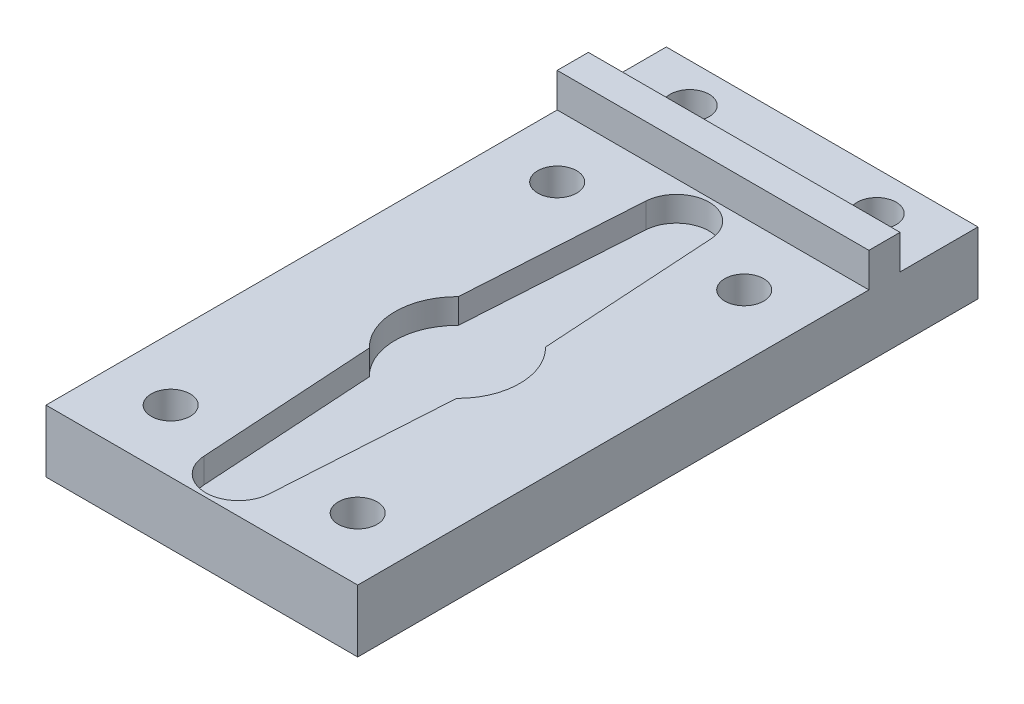
from build123d import *

# Parameters (mm, degrees)
SKETCH_1_W          = 20
SKETCH_1_H          = 32.8
EXTRUDE_1_DEPTH     = 4
CUT_EXTRUDE_1_DEPTH = 1.6
SKETCH_4_R          = 2
CUT_EXTRUDE_2_DEPTH = 1.5
SKETCH_4_3_R        = 1.25
CUT_EXTRUDE_3_DEPTH = 39.624344655
SKETCH_5_W          = 20
SKETCH_5_H          = 6.2
EXTRUDE_4_DEPTH     = 2
EXTRUDE_START       = 2
SKETCH_5_6_W        = 20
SKETCH_5_6_H        = 4
EXTRUDE_5_DEPTH     = 5
SKETCH_6_R          = 1.25
CUT_EXTRUDE_4_DEPTH = 39.913750783
SKETCH_6_3_R        = 2
CUT_EXTRUDE_5_DEPTH = 1.5


with BuildPart() as part:
    # 草图1 → 凸台-拉伸1 (new body)
    with BuildSketch(Plane(origin=(0, 0, 0), x_dir=(1, 0, 0), z_dir=(0, 1, 0))):
        with Locations((10, -16.4)):
            Rectangle(SKETCH_1_W, SKETCH_1_H)
    extrude(amount=EXTRUDE_1_DEPTH)

    # 草图3 → 切除-拉伸1 (cut)
    with BuildSketch(Plane(origin=(0, 4, 0), x_dir=(-1, 0, 0), z_dir=(0, 1, 0))):
        with BuildLine():
            Line((-12.8, 13.543428629), (-12.095952788, 2.219685343))
            ThreePointArc((-12.095952788, 2.219685343), (-10, 0.25), (-7.904047212, 2.219685343))
            Line((-7.904047212, 2.219685343), (-7.2, 13.543428629))
            ThreePointArc((-7.2, 13.543428629), (-6, 16.4), (-7.2, 19.256571371))
            Line((-7.2, 19.256571371), (-7.904047212, 30.580314657))
            ThreePointArc((-7.904047212, 30.580314657), (-10, 32.55), (-12.095952788, 30.580314657))
            Line((-12.095952788, 30.580314657), (-12.8, 19.256571371))
            ThreePointArc((-12.8, 19.256571371), (-14, 16.4), (-12.8, 13.543428629))
        make_face()
    extrude(amount=-CUT_EXTRUDE_1_DEPTH, mode=Mode.SUBTRACT)

    # 草图4 → 切除-拉伸2 (cut)
    with BuildSketch(Plane.XZ):
        with Locations(Location((4, 4, 0), (0, 0, 270))):
            Circle(SKETCH_4_R)
        with Locations(Location((4, 28.8, 0), (0, 0, 270))):
            Circle(SKETCH_4_R)
        with Locations(Location((16, 28.8, 0), (0, 0, 270))):
            Circle(SKETCH_4_R)
        with Locations(Location((16, 4, 0), (0, 0, 270))):
            Circle(SKETCH_4_R)
    extrude(amount=-CUT_EXTRUDE_2_DEPTH, mode=Mode.SUBTRACT)

    # 草图4<3> → 切除-拉伸3 (cut, through all)
    with BuildSketch(Plane.XZ):
        with Locations(Location((4, 4, 0), (0, 0, 270))):
            Circle(SKETCH_4_3_R)
        with Locations(Location((4, 28.8, 0), (0, 0, 270))):
            Circle(SKETCH_4_3_R)
        with Locations(Location((16, 4, 0), (0, 0, 270))):
            Circle(SKETCH_4_3_R)
        with Locations(Location((16, 28.8, 0), (0, 0, 270))):
            Circle(SKETCH_4_3_R)
    extrude(amount=-CUT_EXTRUDE_3_DEPTH, mode=Mode.SUBTRACT)

    # 草图5 → 凸台-拉伸4 (add)
    with BuildSketch(Plane(origin=(0, 0, 0), x_dir=(-1, 0, 0), z_dir=(0, 0, -1))):
        with Locations((-10, 3.1)):
            Rectangle(SKETCH_5_W, SKETCH_5_H)
    extrude(amount=EXTRUDE_4_DEPTH)

    # 草图5<6> → 凸台-拉伸5 (add)
    with BuildSketch(Plane(origin=(0, 0, 0), x_dir=(-1, 0, 0), z_dir=(0, 0, -1)).offset(EXTRUDE_START)):
        with Locations((-10, 2)):
            Rectangle(SKETCH_5_6_W, SKETCH_5_6_H)
    extrude(amount=EXTRUDE_5_DEPTH)

    # 草图6 → 切除-拉伸4 (cut, through all)
    with BuildSketch(Plane.XZ):
        with Locations(Location((4, -4.5, 0), (0, 0, 270))):
            Circle(SKETCH_6_R)
        with Locations(Location((16, -4.5, 0), (0, 0, 270))):
            Circle(SKETCH_6_R)
    extrude(amount=-CUT_EXTRUDE_4_DEPTH, mode=Mode.SUBTRACT)

    # 草图6<3> → 切除-拉伸5 (cut)
    with BuildSketch(Plane.XZ):
        with Locations(Location((4, -4.5, 0), (0, 0, 270))):
            Circle(SKETCH_6_3_R)
        with Locations(Location((16, -4.5, 0), (0, 0, 270))):
            Circle(SKETCH_6_3_R)
    extrude(amount=-CUT_EXTRUDE_5_DEPTH, mode=Mode.SUBTRACT)


solid = part.part
